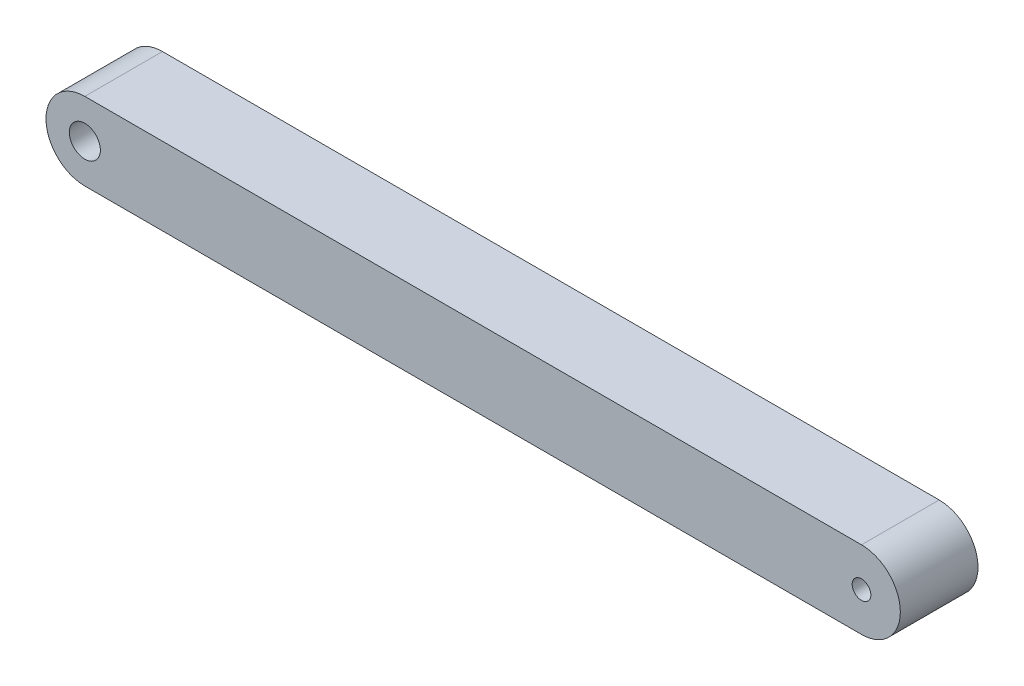
from build123d import *

# Parameters (mm, degrees)
EXTRUDE_1_DEPTH     = 10
SKETCH_2_R          = 2
CUT_EXTRUDE_1_DEPTH = 84.149305617
SKETCH_3_R          = 1.2
CUT_EXTRUDE_2_DEPTH = 84.149305617


with BuildPart() as part:
    # 草图1 → 凸台-拉伸1 (new body)
    with BuildSketch(Plane.XY):
        with BuildLine():
            Line((-77.394217179, 5), (22.605782821, 5))
            ThreePointArc((22.605782821, 5), (27.605782821, 0), (22.605782821, -5))
            Line((22.605782821, -5), (-77.394217179, -5))
            ThreePointArc((-77.394217179, -5), (-82.394217179, 0), (-77.394217179, 5))
        make_face()
    extrude(amount=EXTRUDE_1_DEPTH)

    # 草图2 → 切除-拉伸1 (cut, through all)
    with BuildSketch(Plane.XY.offset(10)):
        with Locations((-77.394217179, 0)):
            Circle(SKETCH_2_R)
    extrude(amount=-CUT_EXTRUDE_1_DEPTH, mode=Mode.SUBTRACT)

    # 草图3 → 切除-拉伸2 (cut, through all)
    with BuildSketch(Plane.XY.offset(10)):
        with Locations((22.605782821, 0)):
            Circle(SKETCH_3_R)
    extrude(amount=-CUT_EXTRUDE_2_DEPTH, mode=Mode.SUBTRACT)


solid = part.part
